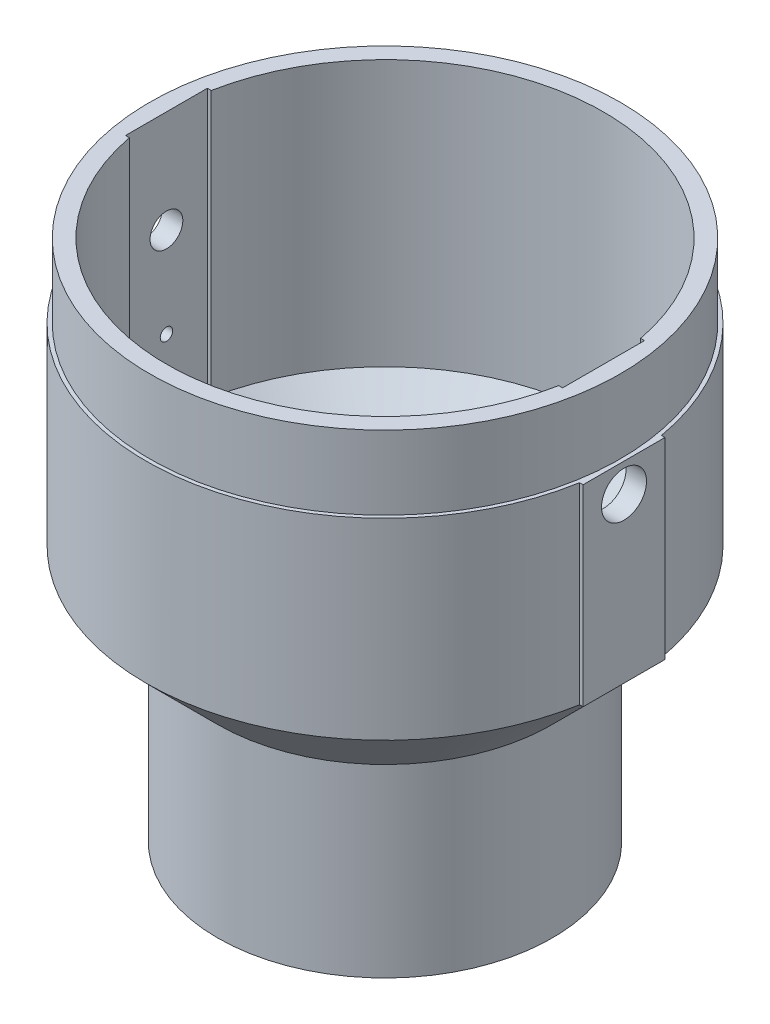
from build123d import *

# Parameters (mm, degrees)
SKETCH14_W              = 0.91
SKETCH14_H              = 18
SKETCH8_W               = 20
SKETCH8_H               = 47
BOSS_EXTRUDE1_DEPTH     = 0.862384063
CUT_EXTRUDE4_REACH      = 181.492
CUT_EXTRUDE4_END_RADIUS = 53.41
SKETCH10_W              = 20
SKETCH10_H              = 65
CIRPATTERN1_COUNT       = 2
SKETCH11_R              = 5.5
CUT_EXTRUDE5_DEPTH      = 5
SKETCH12_R              = 4
SKETCH12_R_2            = 1.515
CUT_EXTRUDE6_DEPTH      = 5


with BuildPart() as part:
    # Sketch1 → Revolve1 (revolve)
    with BuildSketch(Plane.XY, mode=Mode.PRIVATE) as revolve1_sk:
        Polygon((58.41, -65), (40.91, -82.5), (40.91, -127.679491924), (35.91, -127.679491924), (35.91, -82.5), (53.41, -65), (53.41, 0), (58.41, 0), align=None)
    revolve(revolve1_sk.sketch.rotate(Axis((0, 0, 0), (0, -1, 0)), 90), axis=Axis((0, 0, 0), (0, -1, 0)))

    # Sketch14 → Cut-Revolve5 (revolve, cut)
    with BuildSketch(Plane.XY, mode=Mode.PRIVATE) as cut_revolve5_sk:
        with Locations((-57.955, -9)):
            Rectangle(SKETCH14_W, SKETCH14_H)
    revolve(cut_revolve5_sk.sketch.rotate(Axis((0, 0, 0), (0, 1, 0)), 90), axis=Axis((0, 0, 0), (0, 1, 0)), mode=Mode.SUBTRACT)

    # Sketch8 → Boss-Extrude1 (add)
    with BuildSketch(Plane.ZY.offset(58.41)):
        with Locations((0, -41.5)):
            Rectangle(SKETCH8_W, SKETCH8_H)
    boss_extrude1 = extrude(amount=-BOSS_EXTRUDE1_DEPTH)

    # Cut-Extrude4: up to this cylinder (the profile starts outside it)
    cut_extrude4_end = Plane(origin=(0, -32.5, 0), z_dir=(0, 1, 0)) * Cylinder(CUT_EXTRUDE4_END_RADIUS, 470.804, mode=Mode.PRIVATE)
    # Sketch10 → Cut-Extrude4 (cut, up to the surface)
    with BuildSketch(Plane(origin=(-53.41, 0, 0), x_dir=(0, 0, -1), z_dir=(1, 0, 0)), mode=Mode.PRIVATE) as cut_extrude4_sk1:
        with Locations((0, -32.5)):
            Rectangle(SKETCH10_W, SKETCH10_H)
    cut_extrude4_tool1 = extrude(cut_extrude4_sk1.sketch, amount=CUT_EXTRUDE4_REACH, mode=Mode.PRIVATE) - cut_extrude4_end
    cut_extrude4 = cut_extrude4_tool1.solids().sort_by_distance((-53.41, -32.5, 0))[0] + cut_extrude4_tool1.solids().sort_by_distance((-53.41, -32.5, 0))[1]
    add(cut_extrude4, mode=Mode.SUBTRACT)

    # CirPattern1: Boss-Extrude1, Cut-Extrude4 ×2 about axis
    cirpattern1_axis = Axis((0, 0, 0), (0, 1, 0))
    add([boss_extrude1.rotate(cirpattern1_axis, i * 360 / CIRPATTERN1_COUNT) for i in range(1, CIRPATTERN1_COUNT)])
    add([cut_extrude4.rotate(cirpattern1_axis, i * 360 / CIRPATTERN1_COUNT) for i in range(1, CIRPATTERN1_COUNT)], mode=Mode.SUBTRACT)

    # Sketch11 → Cut-Extrude5 (cut)
    with BuildSketch(Plane(origin=(58.41, 0, 0), x_dir=(0, 0, -1), z_dir=(1, 0, 0))):
        with Locations((0, -25)):
            Circle(SKETCH11_R)
    extrude(amount=-CUT_EXTRUDE5_DEPTH, mode=Mode.SUBTRACT)

    # Sketch12 → Cut-Extrude6 (cut)
    with BuildSketch(Plane.ZY.offset(58.41)):
        with Locations((0, -25)):
            Circle(SKETCH12_R)
        with Locations((0, -47.0538)):
            Circle(SKETCH12_R_2)
        with Locations((0, -57.0538)):
            Circle(SKETCH12_R_2)
    extrude(amount=-CUT_EXTRUDE6_DEPTH, mode=Mode.SUBTRACT)


solid = part.part
